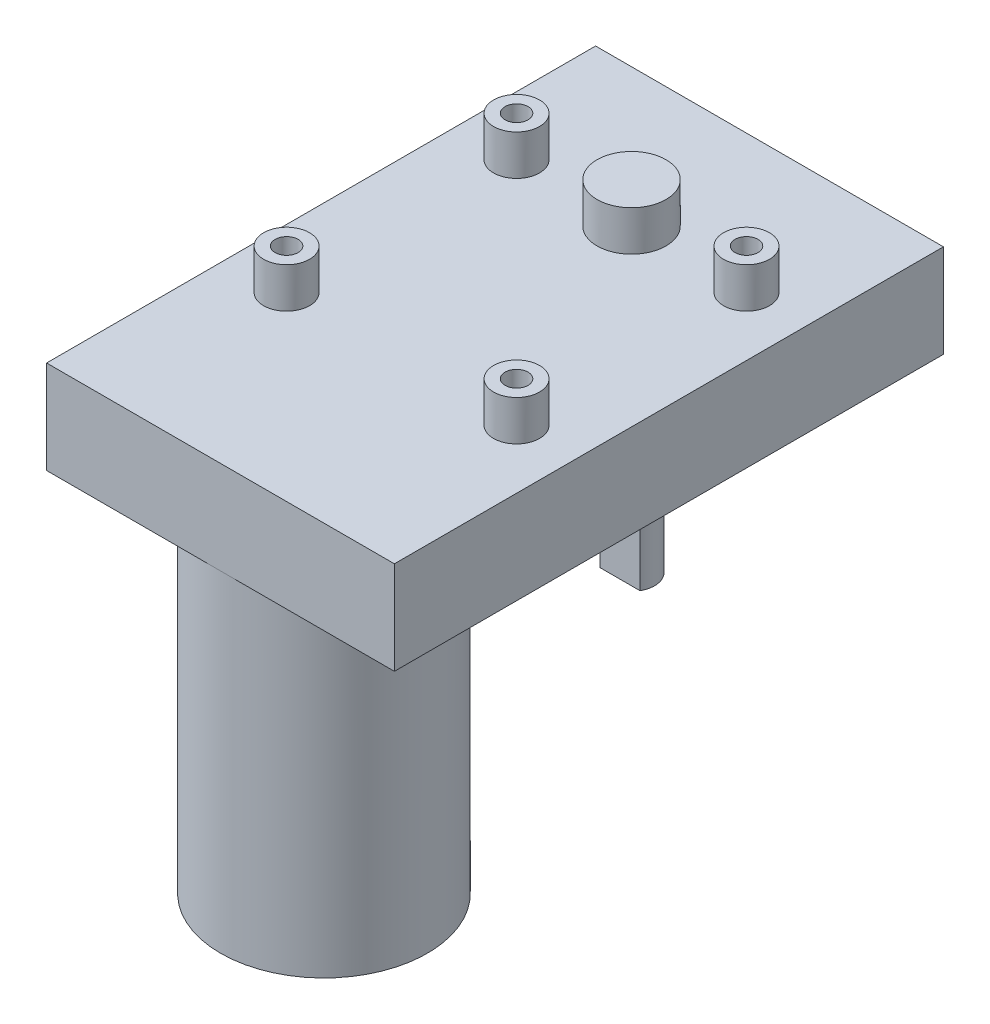
from build123d import *

# Parameters (mm, degrees)
SKETCH_1_W          = 60.5
SKETCH_1_H          = 95.5
EXTRUDE_1_DEPTH     = 16.2
SKETCH_2_R          = 6
SKETCH_2_R_2        = 4
SKETCH_2_R_3        = 2
EXTRUDE_2_DEPTH     = 7
EXTRUDE_START       = 6
SKETCH_7_R          = 6
EXTRUDE_6_DEPTH     = 6
SKETCH_3_R          = 4
EXTRUDE_3_DEPTH     = 30
CUT_EXTRUDE_START   = -16
CUT_EXTRUDE_1_DEPTH = 16
SKETCH_5_R          = 4
SKETCH_5_R_2        = 2
EXTRUDE_4_DEPTH     = 8
SKETCH_6_R          = 18
EXTRUDE_5_DEPTH     = 57.6


with BuildPart() as part:
    # 草图1 → 凸台-拉伸1 (new body)
    with BuildSketch(Plane(origin=(0, 0, 0), x_dir=(1, 0, 0), z_dir=(0, 1, 0))):
        with Locations((0, -23.75)):
            Rectangle(SKETCH_1_W, SKETCH_1_H)
    extrude(amount=EXTRUDE_1_DEPTH)

    # 草图2 → 凸台-拉伸2 (add)
    # profile 1 of 5: a face of its own
    with BuildSketch(Plane(origin=(0, 16.2, 0), x_dir=(1, 0, 0), z_dir=(0, 1, 0))):
        with Locations(Location((0, 0, 0), (0, 0, 90))):
            Circle(SKETCH_2_R)
    # profile 2 of 5: a face of its own
    with BuildSketch(Plane(origin=(0, 16.2, 0), x_dir=(1, 0, 0), z_dir=(0, 1, 0))):
        with Locations(Location((-20, 0, 0), (0, 0, 90))):
            Circle(SKETCH_2_R_2)
        with Locations(Location((-20, 0, 0), (0, 0, 270))):
            Circle(SKETCH_2_R_3, mode=Mode.SUBTRACT)
    # profile 3 of 5: a face of its own
    with BuildSketch(Plane(origin=(0, 16.2, 0), x_dir=(1, 0, 0), z_dir=(0, 1, 0))):
        with Locations(Location((20, 0, 0), (0, 0, 90))):
            Circle(SKETCH_2_R_2)
        with Locations(Location((20, 0, 0), (0, 0, 270))):
            Circle(SKETCH_2_R_3, mode=Mode.SUBTRACT)
    # profile 4 of 5: a face of its own
    with BuildSketch(Plane(origin=(0, 16.2, 0), x_dir=(1, 0, 0), z_dir=(0, 1, 0))):
        with Locations(Location((20, -40, 0), (0, 0, 90))):
            Circle(SKETCH_2_R_2)
        with Locations(Location((20, -40, 0), (0, 0, 270))):
            Circle(SKETCH_2_R_3, mode=Mode.SUBTRACT)
    # profile 5 of 5: a face of its own
    with BuildSketch(Plane(origin=(0, 16.2, 0), x_dir=(1, 0, 0), z_dir=(0, 1, 0))):
        with Locations(Location((-20, -40, 0), (0, 0, 90))):
            Circle(SKETCH_2_R_2)
        with Locations(Location((-20, -40, 0), (0, 0, 270))):
            Circle(SKETCH_2_R_3, mode=Mode.SUBTRACT)
    extrude(amount=EXTRUDE_2_DEPTH)

    # 草图7 → 凸台-拉伸6 (add)
    with BuildSketch(Plane.XZ.offset(EXTRUDE_START)):
        with Locations(Location((0, 0, 0), (0, 0, 270))):
            Circle(SKETCH_7_R)
    extrude(amount=-EXTRUDE_6_DEPTH)

    # 草图3 → 凸台-拉伸3 (add)
    with BuildSketch(Plane(origin=(0, -6, 0), x_dir=(1, 0, 0), z_dir=(0, 1, 0))):
        with Locations(Location((0, 0, 0), (0, 0, 270))):
            Circle(SKETCH_3_R)
    extrude(amount=-EXTRUDE_3_DEPTH)

    # 草图4 → 切除-拉伸1 (cut)
    with BuildSketch(Plane(origin=(0, -36, 0), x_dir=(-1, 0, 0), z_dir=(0, -1, 0)).offset(CUT_EXTRUDE_START)):
        with BuildLine():
            Line((-3.464101615, -2), (3.464101615, -2))
            ThreePointArc((3.464101615, -2), (0, -4), (-3.464101615, -2))
        make_face()
    extrude(amount=CUT_EXTRUDE_1_DEPTH, mode=Mode.SUBTRACT)

    # 草图5 → 凸台-拉伸4 (add)
    # profile 1 of 4: a face of its own
    with BuildSketch(Plane(origin=(0, 0, 0), x_dir=(-1, 0, 0), z_dir=(0, -1, 0))):
        with Locations(Location((-17.5, 12.5, 0), (0, 0, 90))):
            Circle(SKETCH_5_R)
        with Locations(Location((-17.5, 12.5, 0), (0, 0, 90))):
            Circle(SKETCH_5_R_2, mode=Mode.SUBTRACT)
    # profile 2 of 4: a face of its own
    with BuildSketch(Plane(origin=(0, 0, 0), x_dir=(-1, 0, 0), z_dir=(0, -1, 0))):
        with Locations(Location((17.5, 12.5, 0), (0, 0, 90))):
            Circle(SKETCH_5_R)
        with Locations(Location((17.5, 12.5, 0), (0, 0, 90))):
            Circle(SKETCH_5_R_2, mode=Mode.SUBTRACT)
    # profile 3 of 4: a face of its own
    with BuildSketch(Plane(origin=(0, 0, 0), x_dir=(-1, 0, 0), z_dir=(0, -1, 0))):
        with Locations(Location((17.5, -12.5, 0), (0, 0, 90))):
            Circle(SKETCH_5_R)
        with Locations(Location((17.5, -12.5, 0), (0, 0, 90))):
            Circle(SKETCH_5_R_2, mode=Mode.SUBTRACT)
    # profile 4 of 4: a face of its own
    with BuildSketch(Plane(origin=(0, 0, 0), x_dir=(-1, 0, 0), z_dir=(0, -1, 0))):
        with Locations(Location((-17.5, -12.5, 0), (0, 0, 90))):
            Circle(SKETCH_5_R)
        with Locations(Location((-17.5, -12.5, 0), (0, 0, 90))):
            Circle(SKETCH_5_R_2, mode=Mode.SUBTRACT)
    extrude(amount=EXTRUDE_4_DEPTH)

    # 草图6 → 凸台-拉伸5 (add)
    with BuildSketch(Plane.XZ):
        with Locations(Location((0, 53.5, 0), (0, 0, 90))):
            Circle(SKETCH_6_R)
    extrude(amount=EXTRUDE_5_DEPTH)


solid = part.part
